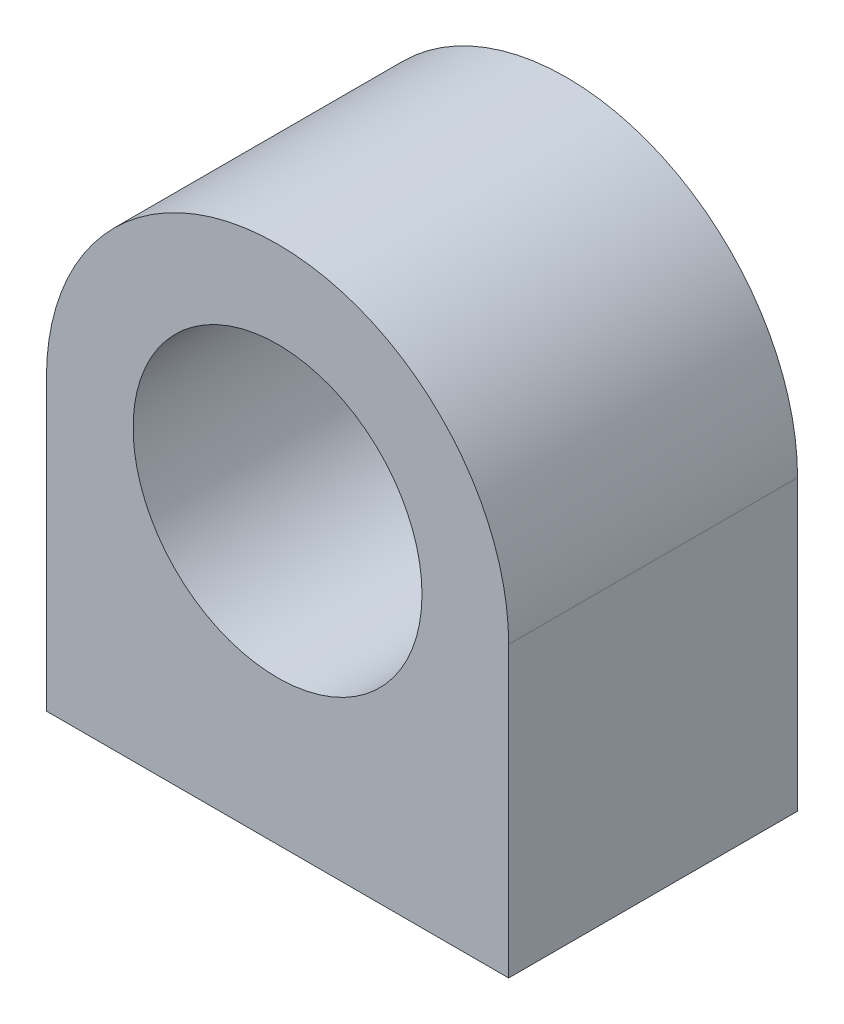
from build123d import *

# Parameters (mm, degrees)
SKETCH1_R           = 2.5
BOSS_EXTRUDE1_DEPTH = 2.5


with BuildPart() as part:
    # Sketch1 → Boss-Extrude1 (new, symmetric)
    with BuildSketch(Plane.XY):
        with BuildLine():
            Line((-4, 0), (4, 0))
            Line((4, 0), (4, 5))
            ThreePointArc((4, 5), (0, 9), (-4, 5))
            Line((-4, 5), (-4, 0))
        make_face()
        with Locations((0, 5)):
            Circle(SKETCH1_R, mode=Mode.SUBTRACT)
    extrude(amount=BOSS_EXTRUDE1_DEPTH, both=True)


solid = part.part
